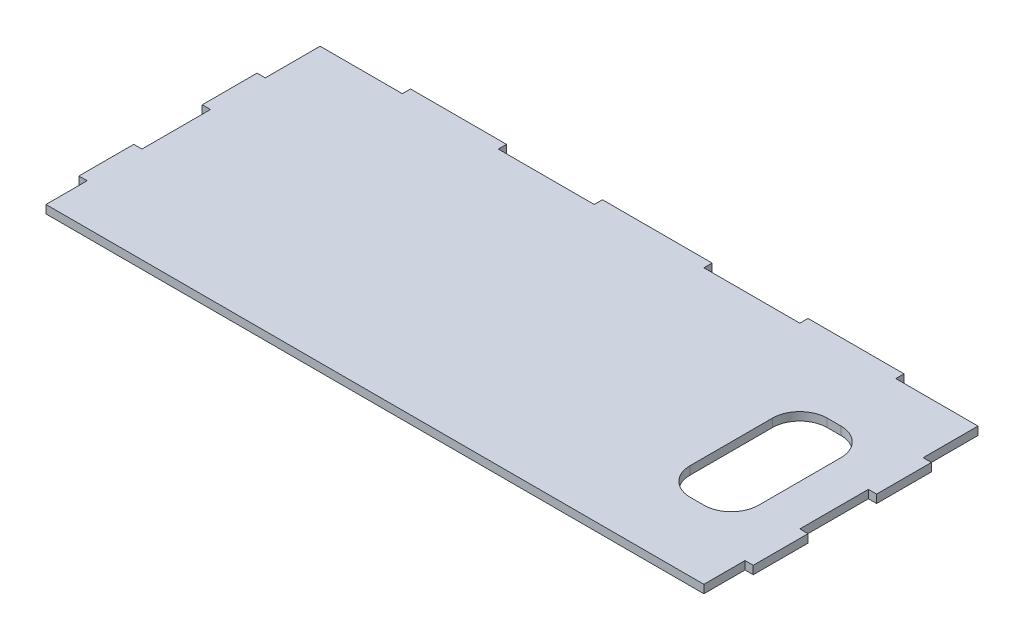
from build123d import *

# Parameters (mm, degrees)
SKETCH2_W           = 240
SKETCH2_H           = 3
BOSS_EXTRUDE1_DEPTH = 100
SKETCH3_W           = 20
SKETCH3_H           = 3
BOSS_EXTRUDE2_DEPTH = 3
BOSS_EXTRUDE3_START = -240
SKETCH3_2_W         = 20
SKETCH3_2_H         = 3
BOSS_EXTRUDE3_DEPTH = 3
SKETCH4_W           = 35
SKETCH4_H           = 3
SKETCH4_W_2         = 40
BOSS_EXTRUDE4_DEPTH = 3
CUT_EXTRUDE1_DEPTH  = 3


with BuildPart() as part:
    # Sketch2 → Boss-Extrude1 (new body)
    with BuildSketch(Plane.XY):
        Rectangle(SKETCH2_W, SKETCH2_H)
    extrude(amount=BOSS_EXTRUDE1_DEPTH)

    # Sketch3 → Boss-Extrude2 (add)
    with BuildSketch(Plane.ZY.offset(120)):
        with Locations((30, 0)):
            Rectangle(SKETCH3_W, SKETCH3_H)
        with Locations((75, 0)):
            Rectangle(SKETCH3_W, SKETCH3_H)
    extrude(amount=BOSS_EXTRUDE2_DEPTH)

    # Sketch3<2> → Boss-Extrude3 (add)
    with BuildSketch(Plane.ZY.offset(120).offset(BOSS_EXTRUDE3_START)):
        with Locations((30, 0)):
            Rectangle(SKETCH3_2_W, SKETCH3_2_H)
        with Locations((75, 0)):
            Rectangle(SKETCH3_2_W, SKETCH3_2_H)
    extrude(amount=-BOSS_EXTRUDE3_DEPTH)

    # Sketch4 → Boss-Extrude4 (add)
    with BuildSketch(Plane(origin=(0, 0, 0), x_dir=(-1, 0, 0), z_dir=(0, 0, -1))):
        with Locations((-72.5, 0)):
            Rectangle(SKETCH4_W, SKETCH4_H)
        Rectangle(SKETCH4_W_2, SKETCH4_H)
        with Locations((72.5, 0)):
            Rectangle(SKETCH4_W, SKETCH4_H)
    extrude(amount=BOSS_EXTRUDE4_DEPTH)

    # Sketch5 → Cut-Extrude1 (cut)
    with BuildSketch(Plane(origin=(0, 1.5, 0), x_dir=(1, 0, 0), z_dir=(0, 1, 0))):
        with BuildLine():
            Line((90, -25), (95, -25))
            ThreePointArc((95, -25), (102.071067812, -27.928932188), (105, -35))
            Line((105, -35), (105, -65))
            ThreePointArc((105, -65), (102.071067812, -72.071067812), (95, -75))
            Line((95, -75), (90, -75))
            ThreePointArc((90, -75), (82.928932188, -72.071067812), (80, -65))
            Line((80, -65), (80, -35))
            ThreePointArc((80, -35), (82.928932188, -27.928932188), (90, -25))
        make_face()
    extrude(amount=-CUT_EXTRUDE1_DEPTH, mode=Mode.SUBTRACT)


solid = part.part
